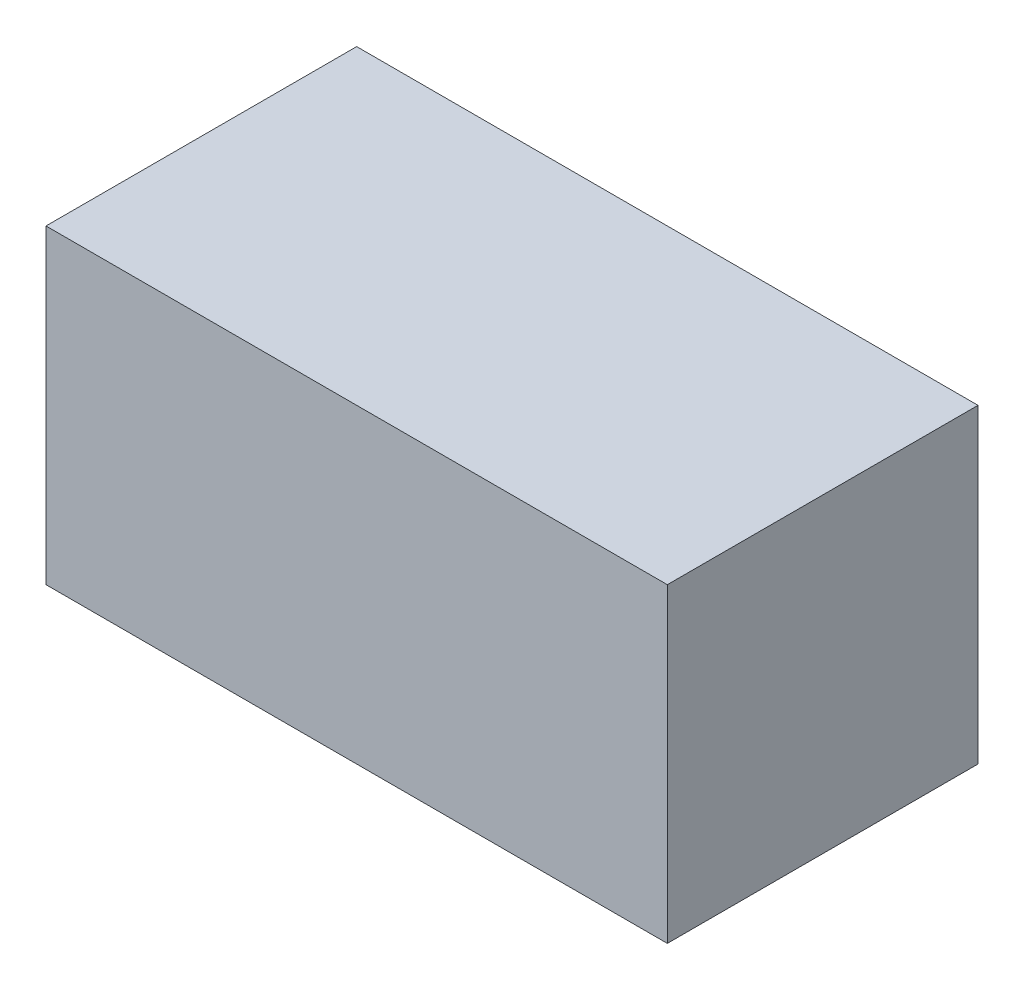
from build123d import *

# Parameters (mm, degrees)
SKETCH1_W           = 40
SKETCH1_H           = 20
BOSS_EXTRUDE1_DEPTH = 20


with BuildPart() as part:
    # Sketch1 → Boss-Extrude1 (new body)
    with BuildSketch(Plane.XY):
        Rectangle(SKETCH1_W, SKETCH1_H)
    extrude(amount=BOSS_EXTRUDE1_DEPTH)


solid = part.part
